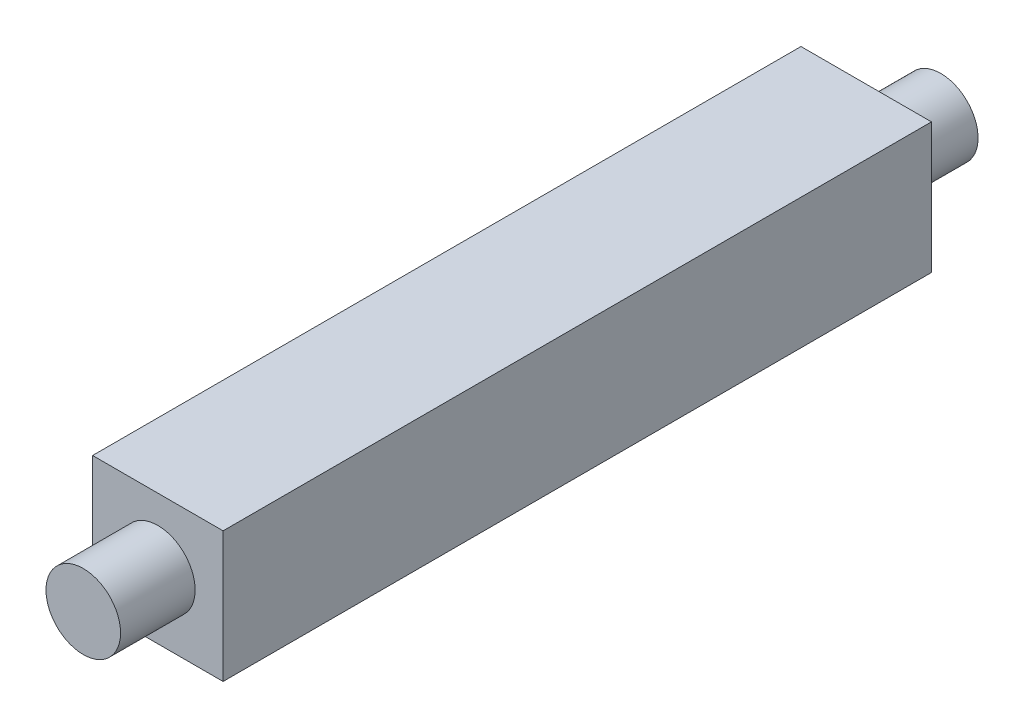
from build123d import *

# Parameters (mm, degrees)
CROQUIS1_W              = 3.5
CROQUIS1_H              = 3.5
SALIENTE_EXTRUIR1_DEPTH = 19
CROQUIS2_R              = 1
SALIENTE_EXTRUIR2_DEPTH = 2
SALIENTE_EXTRUIR3_START = 2
CROQUIS3_R              = 1
SALIENTE_EXTRUIR3_DEPTH = 2


with BuildPart() as part:
    # Croquis1 → Saliente-Extruir1 (new body)
    with BuildSketch(Plane.XY):
        Rectangle(CROQUIS1_W, CROQUIS1_H)
    extrude(amount=SALIENTE_EXTRUIR1_DEPTH)

    # Croquis2 → Saliente-Extruir2 (add)
    with BuildSketch(Plane.XY.offset(19)):
        with Locations(Location((0, 0, 0), (0, 0, 180))):
            Circle(CROQUIS2_R)
    extrude(amount=SALIENTE_EXTRUIR2_DEPTH)

    # Croquis3 → Saliente-Extruir3 (add)
    with BuildSketch(Plane(origin=(0, 0, 0), x_dir=(-1, 0, 0), z_dir=(0, 0, -1)).offset(SALIENTE_EXTRUIR3_START)):
        Circle(CROQUIS3_R)
    extrude(amount=-SALIENTE_EXTRUIR3_DEPTH)


solid = part.part
